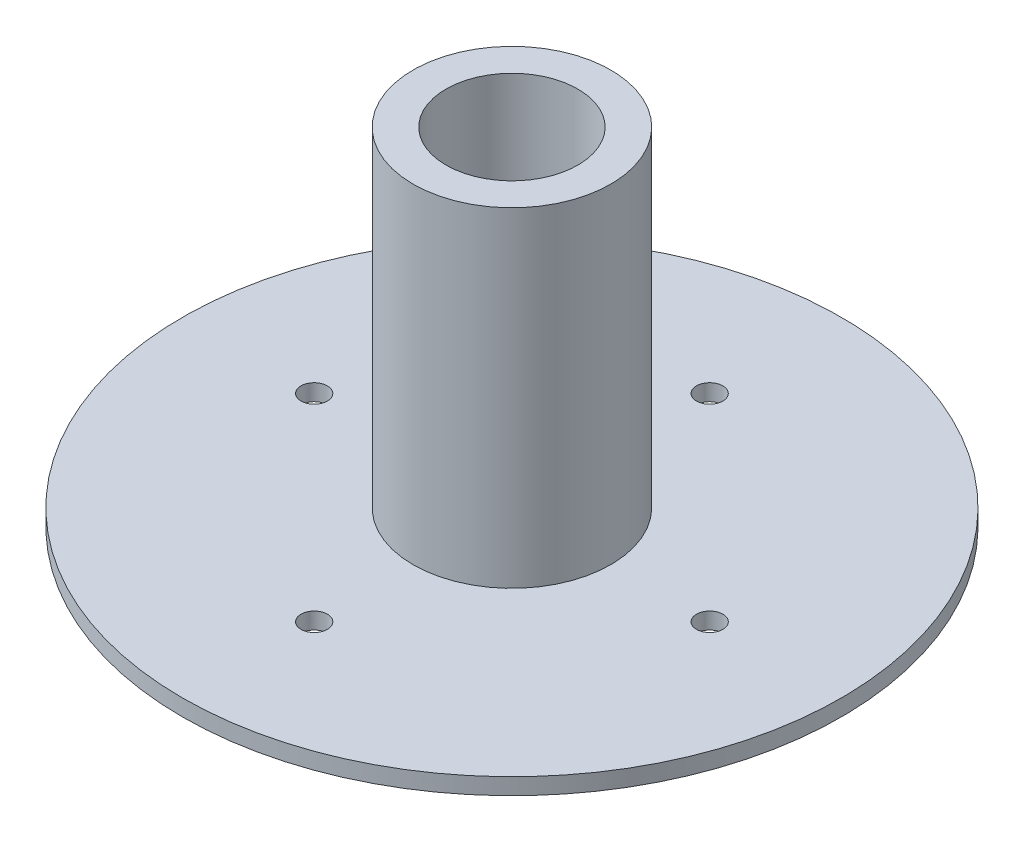
from build123d import *

# Parameters (mm, degrees)
SKETCH_1_R      = 100
EXTRUDE_1_DEPTH = 5
MM_2_D          = 8
MM_2_DEPTH      = 20
MM_2_TIP        = 2.403442476
SKETCH_6_R      = 30
SKETCH_6_R_2    = 20
EXTRUDE_2_DEPTH = 100


with BuildPart() as part:
    # 草图1 → 凸台-拉伸1 (new body)
    with BuildSketch(Plane(origin=(0, 0, 0), x_dir=(1, 0, 0), z_dir=(0, 1, 0))):
        with Locations(Location((0, 0, 0), (0, 0, 270))):
            Circle(SKETCH_1_R)
    extrude(amount=EXTRUDE_1_DEPTH)

    # 大小mm 暗销孔2
    with Locations(Plane(origin=(0, 5, -60), x_dir=(0, 0, 1), z_dir=(0, 1, 0))):
        with Locations((0, 0), (60, -60), (120, 0), (60, 60)):
            Hole(MM_2_D / 2, depth=MM_2_DEPTH)
            with Locations((0, 0, -(MM_2_DEPTH + MM_2_TIP / 2))):  # 118° drill point
                Cone(0, MM_2_D / 2, MM_2_TIP, mode=Mode.SUBTRACT)

    # 草图6 → 凸台-拉伸2 (add)
    with BuildSketch(Plane(origin=(0, 5, 0), x_dir=(1, 0, 0), z_dir=(0, 1, 0))):
        with Locations(Location((0, 0, 0), (0, 0, 270))):
            Circle(SKETCH_6_R)
        with Locations(Location((0, 0, 0), (0, 0, 270))):
            Circle(SKETCH_6_R_2, mode=Mode.SUBTRACT)
    extrude(amount=EXTRUDE_2_DEPTH)


solid = part.part
